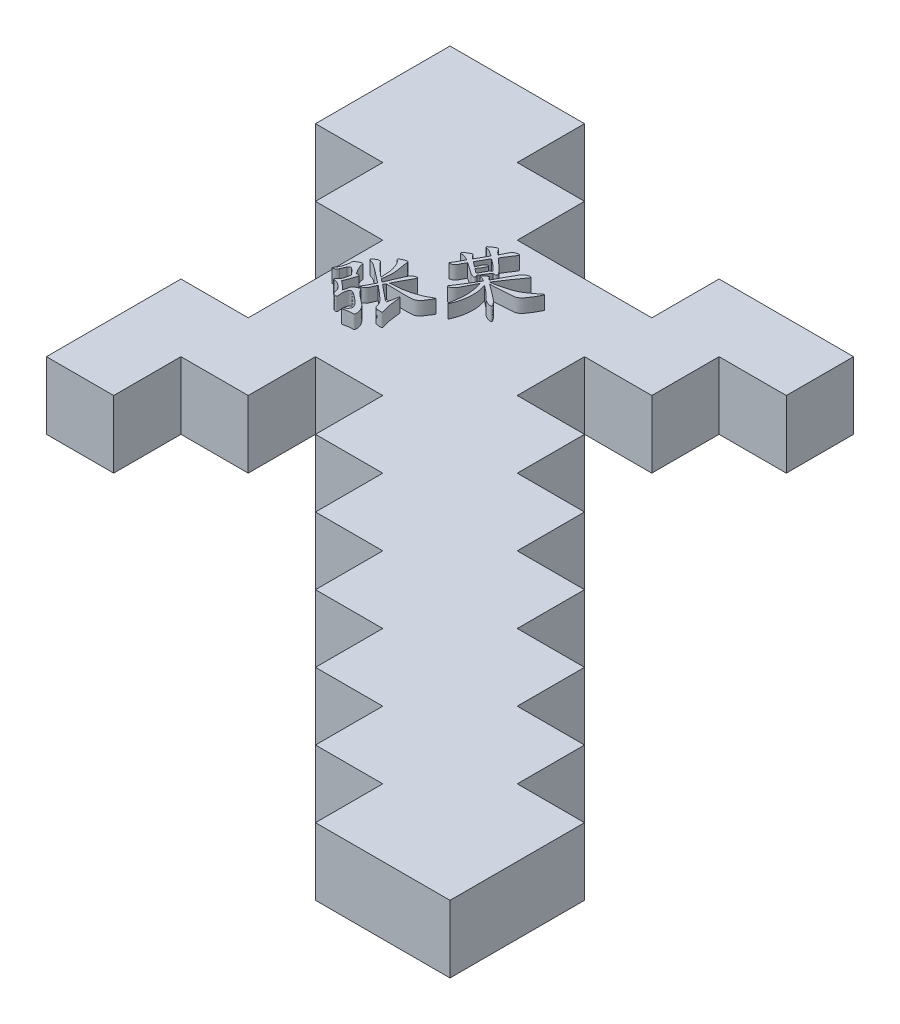
from build123d import *

# Parameters (mm, degrees)
EXTRUDE_1_DEPTH = 5
EXTRUDE_3_DEPTH = 1


with BuildPart() as part:
    # 草图1 → 凸台-拉伸1 (new body)
    with BuildSketch(Plane(origin=(0, 0, 0), x_dir=(1, 0, 0), z_dir=(0, 1, 0))):
        Polygon((-63.130219561, 0), (-58.130219561, 0), (-58.130219561, -5), (-48.130219561, -5), (-48.130219561, 0), (-38.130219561, 0), (-38.130219561, -5), (-43.130219561, -5), (-43.130219561, -10), (-48.130219561, -10), (-48.130219561, -15), (-43.130219561, -15), (-43.130219561, -20), (-38.130219561, -20), (-38.130219561, -25), (-33.130219561, -25), (-33.130219561, -30), (-28.130219561, -30), (-28.130219561, -35), (-23.130219561, -35), (-23.130219561, -40), (-18.130219561, -40), (-18.130219561, -50), (-28.130219561, -50), (-28.130219561, -45), (-33.130219561, -45), (-33.130219561, -40), (-38.130219561, -40), (-38.130219561, -35), (-43.130219561, -35), (-43.130219561, -30), (-48.130219561, -30), (-48.130219561, -25), (-53.130219561, -25), (-53.130219561, -20), (-58.130219561, -20), (-58.130219561, -25), (-63.130219561, -25), (-63.130219561, -30), (-68.130219561, -30), (-68.130219561, -20), (-63.130219561, -20), (-63.130219561, -10), (-68.130219561, -10), (-68.130219561, -5), (-73.130219561, -5), (-73.130219561, 5), (-63.130219561, 5), align=None)
    extrude(amount=EXTRUDE_1_DEPTH)

    # 草图7 → 凸台-拉伸3 (add)
    # profile 1 of 4: a face of its own
    with BuildSketch(Plane(origin=(0, 5, 0), x_dir=(1, 0, 0), z_dir=(0, 1, 0))):
        with BuildLine():
            add(Edge.make_bspline(
                [(-57.090632259, -7.991469364), (-57.12896008, -7.964786214), (-57.201994845, -7.913940702), (-57.30746532, -7.843172437), (-57.404513995, -7.783973908), (-57.491082161, -7.732761733), (-57.568693791, -7.692958184), (-57.636875541, -7.662967515), (-57.695459543, -7.641846621), (-57.745679395, -7.63263725), (-57.785831557, -7.628643865), (-57.815738119, -7.619157593), (-57.836430406, -7.606788832), (-57.847539113, -7.588609972), (-57.844109679, -7.566813763), (-57.830602901, -7.544182993), (-57.806964247, -7.519052656), (-57.737961053, -7.461205612), (-57.622041523, -7.378762702), (-57.503689201, -7.299160746), (-57.422609131, -7.256327718), (-57.384304212, -7.24359624), (-57.347610554, -7.239890388), (-57.313150835, -7.244110341), (-57.280601593, -7.256757825), (-57.251039659, -7.278258612), (-57.223516, -7.307739117), (-57.191304211, -7.359561129), (-57.145846452, -7.428930716), (-57.075312137, -7.508735389), (-56.993693924, -7.589763513), (-56.930899465, -7.639190311), (-56.898299576, -7.664850348)],
                knots=[0, 0, 0, 0, 1.980602943, 3.774095954, 5.385195833, 6.801005577, 8.03888147, 9.080973192, 9.960130792, 10.671101345, 11.240957986, 11.666977358, 11.993084103, 12.2452693, 12.5158187, 12.87747406, 13.354486223, 13.970874341, 16.69473991, 19.382127449, 20.011995386, 20.577492331, 21.082011399, 21.563561422, 22.036626702, 22.546321976, 23.100837353, 23.736040738, 25.128779013, 26.613925108, 28.24211138, 30, 30, 30, 30], degree=3))
            add(Edge.make_bspline(
                [(-56.898299576, -7.664850348), (-56.856985475, -7.585148952), (-56.772454687, -7.422075773), (-56.685581341, -7.23408478), (-56.619880118, -7.110393941), (-56.581934722, -7.054069149), (-56.539348015, -7.004167973), (-56.491632271, -6.961162856), (-56.440047604, -6.923998498), (-56.383598573, -6.893147043), (-56.322706195, -6.869086519), (-56.260578557, -6.851632102), (-56.203261683, -6.841777798), (-56.156836106, -6.840855176), (-56.121816785, -6.85100808), (-56.101262147, -6.877267375), (-56.103866071, -6.913903429), (-56.118399667, -6.957234258), (-56.147233187, -7.010977108), (-56.189984505, -7.073073942), (-56.240971021, -7.144470289), (-56.295010499, -7.225128986), (-56.353329609, -7.312271474), (-56.413494771, -7.407390591), (-56.479285222, -7.507990442), (-56.545055863, -7.617991273), (-56.61685558, -7.733560633), (-56.66425942, -7.814052595), (-56.688639624, -7.855450304)],
                knots=[0, 0, 0, 0, 2.929307648, 5.99351495, 6.756949934, 7.496690693, 8.205090066, 8.892296591, 9.587981125, 10.275446096, 10.985973739, 11.719989098, 12.378484629, 12.878066999, 13.229939503, 13.525871825, 13.884123202, 14.36707224, 15.024622916, 15.861062095, 16.828476243, 17.887118453, 19.02937812, 20.250229681, 21.55998466, 22.951640959, 24.432202698, 26, 26, 26, 26], degree=3))
            add(Edge.make_bspline(
                [(-56.688639624, -7.855450304), (-56.64874638, -7.890925945), (-56.571719312, -7.959423371), (-56.460510491, -8.059637954), (-56.356832699, -8.152593593), (-56.261517808, -8.239533851), (-56.17378958, -8.319278736), (-56.09395799, -8.392486201), (-56.023227368, -8.460718857), (-55.939852666, -8.538422275), (-55.850501724, -8.628452734), (-55.760881853, -8.732306263), (-55.692520718, -8.83029081), (-55.650986677, -8.907728163), (-55.631083568, -8.963335694), (-55.630575495, -8.998026759), (-55.645076487, -9.026185325), (-55.674559772, -9.042551328), (-55.714087415, -9.050480371), (-55.765320525, -9.048854303), (-55.828805447, -9.041949362), (-55.874908614, -9.03215634), (-55.900248894, -9.026773674)],
                knots=[0, 0, 0, 0, 1.715642914, 3.312614605, 4.810939105, 6.190629003, 7.458570877, 8.621044157, 9.67137473, 10.616741492, 12.283672131, 13.745331615, 15.019643053, 16.115445615, 16.561696677, 16.905211617, 17.20001396, 17.529580332, 17.948349052, 18.48663537, 19.16818982, 20, 20, 20, 20], degree=3))
            add(Edge.make_bspline(
                [(-55.900248894, -9.026773674), (-55.914969685, -9.049303809), (-55.945901173, -9.096644376), (-55.994601384, -9.170847495), (-56.046000651, -9.252745619), (-56.104004872, -9.340105863), (-56.164775774, -9.435308396), (-56.231286977, -9.536818697), (-56.300852878, -9.645796603), (-56.349267451, -9.720472011), (-56.374149695, -9.758850781)],
                knots=[0, 0, 0, 0, 0.740657657, 1.556277965, 2.442562073, 3.401451536, 4.441972137, 5.550788968, 6.741249494, 8, 8, 8, 8], degree=3))
            add(Edge.make_bspline(
                [(-56.374149695, -9.758850781), (-56.364553618, -9.778038884), (-56.347106758, -9.812925236), (-56.328343113, -9.862071311), (-56.319113736, -9.90255888), (-56.320552791, -9.9349465), (-56.333328113, -9.960394118), (-56.359607974, -9.97261443), (-56.393392552, -9.975169159), (-56.448313307, -9.965068289), (-56.517481136, -9.946248926), (-56.594317454, -9.91952383), (-56.660171818, -9.890269874), (-56.697304277, -9.865051469), (-56.714630527, -9.853284396)],
                knots=[0, 0, 0, 0, 1.244630136, 2.262892048, 3.048600354, 3.637449292, 4.117755162, 4.612754432, 5.236591537, 6.066307333, 7.835000185, 9.398978416, 10.786346188, 12, 12, 12, 12], degree=3))
            add(Edge.make_bspline(
                [(-56.714630527, -9.853284396), (-56.727019832, -9.844004293), (-56.757626891, -9.821078339), (-56.813216872, -9.781410446), (-56.887148903, -9.729554823), (-56.978537963, -9.664102422), (-57.090015406, -9.588537277), (-57.218684431, -9.498985232), (-57.366067005, -9.397765466), (-57.470383232, -9.326239229), (-57.525546706, -9.288415433)],
                knots=[0, 0, 0, 0, 0.375893873, 0.928624027, 1.65826865, 2.568892663, 3.658219232, 4.928502417, 6.375761072, 8, 8, 8, 8], degree=3))
            add(Edge.make_bspline(
                [(-57.525546706, -9.288415433), (-57.566201598, -9.356134451), (-57.648249551, -9.492802062), (-57.72147432, -9.656249331), (-57.772065531, -9.764059822), (-57.802128564, -9.812687155), (-57.837540632, -9.855307547), (-57.875862562, -9.894267652), (-57.918792379, -9.927559647), (-57.9659252, -9.955984447), (-58.016810181, -9.979161243), (-58.069549391, -9.996572275), (-58.118627631, -10.008076496), (-58.159246345, -10.015030164), (-58.189657898, -10.01537959), (-58.211909637, -10.008544156), (-58.22309106, -9.990798747), (-58.218766203, -9.96730001), (-58.204645182, -9.939944189), (-58.190408487, -9.920652857), (-58.182250193, -9.909598019)],
                knots=[0, 0, 0, 0, 3.618561838, 7.3028259, 8.203039248, 9.07756078, 9.915209135, 10.739243148, 11.57898249, 12.398856036, 13.258104, 14.137524852, 14.940541, 15.569814485, 16.020261946, 16.335038001, 16.584901296, 16.903828423, 17.371842249, 18, 18, 18, 18], degree=3))
            add(Edge.make_bspline(
                [(-58.182250193, -9.909598019), (-58.170592915, -9.893500294), (-58.14451248, -9.857485398), (-58.103814748, -9.795784756), (-58.058399741, -9.720183123), (-58.006429535, -9.631802678), (-57.948148027, -9.530430617), (-57.885270473, -9.415272293), (-57.816910112, -9.286848335), (-57.76953597, -9.196889), (-57.744736656, -9.149797283)],
                knots=[0, 0, 0, 0, 0.54360168, 1.216181677, 2.020877555, 2.955639438, 4.020635478, 5.219054618, 6.544236745, 8, 8, 8, 8], degree=3))
            add(Edge.make_bspline(
                [(-57.744736656, -9.149797283), (-57.77258089, -9.133323129), (-57.82588684, -9.101784448), (-57.905438934, -9.061085076), (-57.979548375, -9.026309736), (-58.048961229, -8.997937693), (-58.113997517, -8.977898956), (-58.174018178, -8.965072386), (-58.22910009, -8.956674258), (-58.278751473, -8.958980836), (-58.321413866, -8.961492048), (-58.356423281, -8.960360722), (-58.38323063, -8.95499918), (-58.402422008, -8.944845914), (-58.412731802, -8.928749254), (-58.413071481, -8.908563867), (-58.402517436, -8.886231078), (-58.391915176, -8.871477247), (-58.385845601, -8.863030984)],
                knots=[0, 0, 0, 0, 1.962620562, 3.757307723, 5.419287501, 6.929089491, 8.30370031, 9.541006395, 10.653801285, 11.6702689, 12.5471045, 13.248888065, 13.788689604, 14.197385674, 14.528003306, 14.896396965, 15.368210087, 16, 16, 16, 16], degree=3))
            add(Edge.make_bspline(
                [(-58.385845601, -8.863030984), (-58.367692821, -8.841056722), (-58.329809174, -8.795197898), (-58.257720561, -8.735650674), (-58.175311565, -8.676320589), (-58.098785292, -8.631071066), (-58.035462739, -8.599482977), (-57.992347034, -8.580022233), (-57.953869194, -8.566496496), (-57.92010419, -8.559232197), (-57.890876154, -8.557663938), (-57.866671185, -8.562749935), (-57.846599689, -8.573465909), (-57.82697871, -8.600372969), (-57.798663888, -8.644780418), (-57.742790624, -8.703234607), (-57.67037841, -8.778835703), (-57.612856671, -8.831345453), (-57.580993966, -8.860431894)],
                knots=[0, 0, 0, 0, 1.323142054, 2.761309577, 4.330763745, 6.047188682, 6.888276329, 7.622109992, 8.246600159, 8.78142658, 9.224944804, 9.596504791, 9.921424573, 10.255112737, 11.123438005, 12.379622114, 13.994583703, 16, 16, 16, 16], degree=3))
            add(Edge.make_bspline(
                [(-57.580993966, -8.860431894), (-57.541217134, -8.794715502), (-57.459298363, -8.659375261), (-57.33750592, -8.448787813), (-57.214583054, -8.224400992), (-57.132631673, -8.070395779), (-57.090632259, -7.991469364)],
                knots=[0, 0, 0, 0, 0.923680373, 1.902282206, 2.924936748, 4, 4, 4, 4], degree=3))
        make_face()
        with BuildLine():
            add(Edge.make_bspline(
                [(-57.003995915, -9.304876338), (-56.989804481, -9.267811647), (-56.96214773, -9.195578715), (-56.917809122, -9.092164518), (-56.874275855, -8.995646553), (-56.832664972, -8.906886006), (-56.787548422, -8.829702528), (-56.733724293, -8.769547776), (-56.672776645, -8.726814186), (-56.616979132, -8.708547395), (-56.575895076, -8.704578824), (-56.5500887, -8.710321589), (-56.535437613, -8.730504882), (-56.531147003, -8.758126427), (-56.535790853, -8.793841523), (-56.548980028, -8.83824159), (-56.56870414, -8.892186666), (-56.6087279, -8.97350345), (-56.663452511, -9.07669783), (-56.734199964, -9.1939152), (-56.810244169, -9.298010344), (-56.865485881, -9.360424249), (-56.892235032, -9.390646319)],
                knots=[0, 0, 0, 0, 1.500508182, 2.92424136, 4.253563156, 5.503753539, 6.631132626, 7.620512224, 8.532119455, 9.416103834, 9.798899765, 10.095934496, 10.360260676, 10.683624304, 11.133437605, 11.710918479, 12.432991487, 13.302424248, 15.134283063, 16.849677312, 18.47455026, 20, 20, 20, 20], degree=3))
            Line((-56.892235032, -9.390646319), (-56.537892385, -9.663550802))
            add(Edge.make_bspline(
                [(-56.537892385, -9.663550802), (-56.50977451, -9.614804788), (-56.456330272, -9.522152214), (-56.382412864, -9.3903006), (-56.317567246, -9.273388893), (-56.262945794, -9.17147868), (-56.215252068, -9.085607373), (-56.168402385, -9.021012413), (-56.125069498, -8.973306716), (-56.087529694, -8.95355804), (-56.060781455, -8.94236323), (-56.05416543, -8.922619129), (-56.059745946, -8.899742161), (-56.073383962, -8.871988371), (-56.096941078, -8.839345096), (-56.128230827, -8.799857318), (-56.170007507, -8.755643613), (-56.220254606, -8.705359685), (-56.278949938, -8.650538857), (-56.344817717, -8.590776622), (-56.417405562, -8.526719578), (-56.497467368, -8.458905285), (-56.58492382, -8.387637436), (-56.678309152, -8.310736089), (-56.779978694, -8.231472868), (-56.850059428, -8.177142667), (-56.886170488, -8.14914751)],
                knots=[0, 0, 0, 0, 1.987437719, 3.77756469, 5.338834308, 6.707983022, 7.864296221, 8.798638426, 9.534266684, 10.095973164, 10.311129052, 10.508111552, 10.766338905, 11.126796723, 11.596410857, 12.184181197, 12.905962104, 13.742558945, 14.694985448, 15.741949377, 16.883731983, 18.113929583, 19.447279876, 20.868180226, 22.386242204, 24, 24, 24, 24], degree=3))
            add(Edge.make_bspline(
                [(-56.886170488, -8.14914751), (-56.90259621, -8.177469177), (-56.936813856, -8.23646815), (-56.990757086, -8.327835507), (-57.046766795, -8.426493145), (-57.105705036, -8.531922586), (-57.169071683, -8.6434515), (-57.235878514, -8.76193049), (-57.304792703, -8.887644515), (-57.352243208, -8.973365024), (-57.376532194, -9.017243677)],
                knots=[0, 0, 0, 0, 0.788086498, 1.641721677, 2.553944254, 3.518786121, 4.549140596, 5.641593005, 6.792777553, 8, 8, 8, 8], degree=3))
            Line((-57.376532194, -9.017243677), (-57.003995915, -9.304876338))
        make_face(mode=Mode.SUBTRACT)
    # profile 2 of 4: a face of its own
    with BuildSketch(Plane(origin=(0, 5, 0), x_dir=(1, 0, 0), z_dir=(0, 1, 0))):
        with BuildLine():
            add(Edge.make_bspline(
                [(-55.606551688, -9.609836269), (-55.582193816, -9.565995179), (-55.534676167, -9.480469416), (-55.467035345, -9.354826589), (-55.401306311, -9.237438529), (-55.34217627, -9.126164705), (-55.285357498, -9.022764906), (-55.232675527, -8.926530715), (-55.185083733, -8.836664238), (-55.126628957, -8.728144259), (-55.058171212, -8.60032494), (-54.977268206, -8.454205573), (-54.898358521, -8.315905583), (-54.834471214, -8.205024299), (-54.781568483, -8.122400695), (-54.738021929, -8.067311506), (-54.690236665, -8.018675947), (-54.638943934, -7.976331692), (-54.584990472, -7.938941795), (-54.526001716, -7.909797884), (-54.464025722, -7.885415711), (-54.400888549, -7.86825634), (-54.343036039, -7.856274961), (-54.294668121, -7.854195828), (-54.258415938, -7.858328024), (-54.231793735, -7.873729575), (-54.224094026, -7.902132237), (-54.230506686, -7.935573283), (-54.250186048, -7.975754491), (-54.280965119, -8.023662212), (-54.32105888, -8.078349823), (-54.364515738, -8.142224854), (-54.415596416, -8.211315305), (-54.470492848, -8.288029835), (-54.530087751, -8.371756992), (-54.596812898, -8.460505251), (-54.666011293, -8.558096751), (-54.742928026, -8.660353384), (-54.822129484, -8.770258786), (-54.904972949, -8.88676207), (-54.989900956, -9.010174596), (-55.079130573, -9.139551498), (-55.169415691, -9.276327452), (-55.263347517, -9.419332368), (-55.359376865, -9.569493731), (-55.424358304, -9.671905711), (-55.457537176, -9.724196243)],
                knots=[0, 0, 0, 0, 1.448093778, 2.824959963, 4.119986515, 5.332495216, 6.463135999, 7.526563905, 8.500191027, 9.399266558, 11.085596972, 12.686758902, 14.221584836, 15.683108196, 16.381542897, 17.052198558, 17.706693995, 18.346198383, 18.970630196, 19.597118536, 20.241281017, 20.89071083, 21.484376813, 21.943290125, 22.281893549, 22.533982678, 22.77129677, 23.074359428, 23.503603154, 24.054251149, 24.718238636, 25.460774804, 26.284713508, 27.198782654, 28.18458081, 29.251924388, 30.404460495, 31.638567017, 32.946202732, 34.315854113, 35.766106899, 37.271753753, 38.853605973, 40.497956519, 42.211891629, 44, 44, 44, 44], degree=3))
            add(Edge.make_bspline(
                [(-55.457537176, -9.724196243), (-55.426910296, -9.721164949), (-55.362953662, -9.714834843), (-55.262603001, -9.701877884), (-55.153511902, -9.683245928), (-55.035438991, -9.660701448), (-54.908329641, -9.634563466), (-54.772423712, -9.604589869), (-54.628062836, -9.568267161), (-54.476461587, -9.530799297), (-54.323546992, -9.48710453), (-54.173555518, -9.439103319), (-54.029595176, -9.384902195), (-53.890578834, -9.327170885), (-53.757454663, -9.263837471), (-53.629647477, -9.196463823), (-53.508177543, -9.123418091), (-53.393225542, -9.046310963), (-53.284177073, -8.969746739), (-53.182436795, -8.895995133), (-53.087645933, -8.827748583), (-53.00096107, -8.763313286), (-52.921269211, -8.703869718), (-52.849421068, -8.648403063), (-52.784985775, -8.597442234), (-52.730730015, -8.551536911), (-52.685214807, -8.514576172), (-52.652730333, -8.494468411), (-52.623843219, -8.483724099), (-52.608233074, -8.506166437), (-52.617667995, -8.538388838), (-52.631734298, -8.584534111), (-52.659684695, -8.647445571), (-52.712619037, -8.752776318), (-52.788889582, -8.895663145), (-52.891776555, -9.066897092), (-53.001048531, -9.237146663), (-53.097098228, -9.376058452), (-53.178626347, -9.481238333), (-53.242394695, -9.550525036), (-53.308706521, -9.610174912), (-53.377431746, -9.660060522), (-53.448737192, -9.699995681), (-53.522041919, -9.731103318), (-53.598304644, -9.751025847), (-53.758279926, -9.771510743), (-54.009367596, -9.782554534), (-54.264748931, -9.802259059), (-54.445643419, -9.811671496), (-54.546972238, -9.818052311), (-54.656425722, -9.824095907), (-54.773993805, -9.829854328), (-54.899583985, -9.837105608), (-55.033298064, -9.843950933), (-55.175093174, -9.850886142), (-55.272422891, -9.855333355), (-55.32238448, -9.857616213)],
                knots=[0, 0, 0, 0, 0.762831999, 1.592985172, 2.50734523, 3.505507302, 4.572422798, 5.723829828, 6.954729772, 8.262017102, 9.594306489, 10.895917918, 12.164334508, 13.40598958, 14.625913593, 15.817106483, 16.985783706, 18.137257484, 19.247338384, 20.288317479, 21.251924938, 22.142409614, 22.965589841, 23.715824494, 24.393276257, 24.998166537, 25.487855163, 25.818137174, 25.99936551, 26.136867909, 26.388319663, 26.786736603, 27.354441202, 28.081119448, 29.714434732, 31.364339294, 33.032220096, 34.728128327, 35.548690132, 36.328757631, 37.058742334, 37.756059243, 38.429071885, 39.080457978, 39.724606442, 40.375520402, 43.073892076, 45.950312911, 46.724578611, 47.563572594, 48.466882577, 49.441671328, 50.481172739, 51.585004827, 52.760327282, 54, 54, 54, 54], degree=3))
            add(Edge.make_bspline(
                [(-55.32238448, -9.857616213), (-55.28536634, -9.884690184), (-55.21319646, -9.937473097), (-55.108580947, -10.015837158), (-55.008624711, -10.089329052), (-54.914598013, -10.159375164), (-54.825835289, -10.225367481), (-54.743050886, -10.287587511), (-54.665516698, -10.345739171), (-54.593947702, -10.400479489), (-54.527022487, -10.45035399), (-54.466578255, -10.497116043), (-54.411886958, -10.540175247), (-54.361547843, -10.577712773), (-54.317311356, -10.612323594), (-54.279322801, -10.643745828), (-54.2464156, -10.670620475), (-54.192443616, -10.713958537), (-54.119955434, -10.780013587), (-54.03035088, -10.872743232), (-53.947886713, -10.971946952), (-53.886712691, -11.056586913), (-53.845844464, -11.120785169), (-53.831273811, -11.160161768), (-53.829460573, -11.19488877), (-53.853736098, -11.216676736), (-53.8899288, -11.223164692), (-53.939260034, -11.221229288), (-54.00366871, -11.208805619), (-54.079482096, -11.187506598), (-54.159919533, -11.161076112), (-54.237513557, -11.131160962), (-54.307427903, -11.097005744), (-54.371662618, -11.061728287), (-54.42840276, -11.022652555), (-54.479563298, -10.982023042), (-54.523293586, -10.93760087), (-54.56168307, -10.886885792), (-54.607222859, -10.829305795), (-54.669854063, -10.763647842), (-54.751616706, -10.686215058), (-54.851706399, -10.596455014), (-54.972102101, -10.495454817), (-55.109893397, -10.380916307), (-55.268580626, -10.256521504), (-55.380404577, -10.169471284), (-55.439343544, -10.123589789)],
                knots=[0, 0, 0, 0, 1.501754896, 2.92779354, 4.280093925, 5.564287594, 6.767149508, 7.901919288, 8.955365598, 9.940740358, 10.85234071, 11.688364798, 12.443102824, 13.131540216, 13.744458894, 14.282062523, 14.745812665, 15.135710637, 16.548519267, 17.952979937, 19.356262193, 20.765553571, 21.380220535, 21.828777675, 22.150851559, 22.431692751, 22.803270897, 23.332914553, 24.043405402, 24.944944503, 25.910842174, 26.815203775, 27.665334943, 28.457080298, 29.212469701, 29.918414978, 30.59380428, 31.246570945, 31.999767114, 32.996645484, 34.213917869, 35.687177528, 37.398057021, 39.359528095, 41.554149901, 44, 44, 44, 44], degree=3))
            add(Edge.make_bspline(
                [(-55.439343544, -10.123589789), (-55.421808367, -10.179468657), (-55.387305002, -10.289419582), (-55.344743319, -10.45479258), (-55.311111912, -10.617294867), (-55.28523803, -10.777372237), (-55.270347779, -10.935107084), (-55.261682478, -11.090347209), (-55.263932926, -11.243087794), (-55.276565917, -11.440281222), (-55.307834757, -11.676901447), (-55.358660329, -11.947801153), (-55.426918123, -12.201063172), (-55.491509918, -12.379101724), (-55.535841485, -12.489119903), (-55.556357986, -12.534060508), (-55.572594611, -12.572314072), (-55.589337986, -12.601867755), (-55.600862785, -12.625577875), (-55.612882137, -12.640317025), (-55.620773699, -12.649969967), (-55.631513819, -12.652334094), (-55.636478267, -12.641059328), (-55.636870247, -12.626508509), (-55.63839022, -12.604161175), (-55.635965637, -12.574475965), (-55.631448241, -12.537514958), (-55.625526784, -12.492977402), (-55.616493983, -12.441087756), (-55.595181686, -12.318884051), (-55.563249231, -12.128391022), (-55.535473745, -11.869215646), (-55.517532338, -11.606796651), (-55.514182508, -11.385012529), (-55.517788463, -11.204060782), (-55.528729369, -11.063904858), (-55.545143189, -10.919984947), (-55.567867415, -10.772339193), (-55.596619327, -10.620674753), (-55.631033767, -10.46480287), (-55.672920691, -10.305153153), (-55.704731581, -10.198011812), (-55.720911662, -10.143516148)],
                knots=[0, 0, 0, 0, 1.364607632, 2.685091471, 3.977215506, 5.230769511, 6.461554422, 7.667696238, 8.852203677, 10.018796564, 12.270871463, 14.409017383, 16.438248792, 18.375309992, 18.818961485, 19.201609917, 19.526872049, 19.785769601, 19.993629768, 20.137652096, 20.228191238, 20.282447986, 20.355241053, 20.46375455, 20.638856676, 20.868062728, 21.159390495, 21.505824107, 21.915177079, 22.386497863, 24.396804314, 26.414520245, 28.458063063, 30.524361528, 31.581270648, 32.674472412, 33.798899913, 34.956255479, 36.154712866, 37.395612179, 38.675321393, 40, 40, 40, 40], degree=3))
            add(Edge.make_bspline(
                [(-55.720911662, -10.143516148), (-55.753670239, -10.201492691), (-55.816441186, -10.312585505), (-55.904563121, -10.473162185), (-55.984821171, -10.619420234), (-56.054557197, -10.752508018), (-56.115729921, -10.871674097), (-56.167330248, -10.976841272), (-56.210849418, -11.067964241), (-56.243456984, -11.147933298), (-56.273964681, -11.218799532), (-56.309539568, -11.28164513), (-56.349249225, -11.339626139), (-56.39519593, -11.390760904), (-56.444142739, -11.437891937), (-56.49862398, -11.478965871), (-56.557705238, -11.514460618), (-56.618411994, -11.543281245), (-56.674102015, -11.56500219), (-56.719070521, -11.574628832), (-56.752596822, -11.578274175), (-56.776065846, -11.561357819), (-56.775428612, -11.530765058), (-56.761872472, -11.494944975), (-56.736027877, -11.447133978), (-56.680919802, -11.367282764), (-56.599677399, -11.252484623), (-56.498518915, -11.099646519), (-56.390461267, -10.931575339), (-56.276694936, -10.748097651), (-56.155689433, -10.550273905), (-56.028514575, -10.338594771), (-55.893911571, -10.11410547), (-55.802555432, -9.959607854), (-55.755566199, -9.880141662)],
                knots=[0, 0, 0, 0, 1.670719355, 3.201379419, 4.595555756, 5.856298839, 6.971004299, 7.956076705, 8.795620769, 9.503461238, 10.122901107, 10.729538509, 11.312432298, 11.882255365, 12.451156387, 13.01486609, 13.590190392, 14.17676518, 14.701703721, 15.079723248, 15.340662949, 15.516058665, 15.727300357, 16.038942396, 16.489448935, 17.080259619, 18.475170035, 20.016493753, 21.678628498, 23.488097228, 25.43283048, 27.496789432, 29.683763651, 32, 32, 32, 32], degree=3))
            add(Edge.make_bspline(
                [(-55.755566199, -9.880141662), (-55.790496272, -9.859099336), (-55.856194756, -9.819521723), (-55.953331639, -9.771782584), (-56.042949896, -9.740105907), (-56.11169692, -9.728379769), (-56.157509312, -9.723422385), (-56.180437249, -9.711564572), (-56.191017901, -9.690363737), (-56.182201767, -9.665633747), (-56.165877152, -9.636983594), (-56.136093551, -9.603783402), (-56.09519787, -9.564924082), (-56.044639615, -9.523617677), (-55.992533504, -9.482276942), (-55.943369689, -9.447512301), (-55.90071731, -9.421401031), (-55.865270853, -9.402231989), (-55.835421808, -9.391862819), (-55.810966565, -9.389424586), (-55.79107639, -9.397707155), (-55.779080236, -9.424256569), (-55.761842444, -9.461532274), (-55.722589668, -9.507582561), (-55.670734476, -9.558422081), (-55.629147785, -9.591735466), (-55.606551688, -9.609836269)],
                knots=[0, 0, 0, 0, 2.288062034, 4.303518281, 6.066851595, 7.599310386, 8.209699452, 8.646152603, 8.986937049, 9.435268646, 10.03040102, 10.85851265, 11.913249347, 13.202080057, 14.518543954, 15.647286049, 16.578589885, 17.325281578, 17.904528959, 18.342484535, 18.683268981, 19.025207979, 19.916875796, 21.013023883, 22.377028773, 24, 24, 24, 24], degree=3))
        make_face()
    # profile 3 of 4: a face of its own
    with BuildSketch(Plane(origin=(0, 5, 0), x_dir=(1, 0, 0), z_dir=(0, 1, 0))):
        with BuildLine():
            add(Edge.make_bspline(
                [(-59.288790613, -13.857348716), (-59.246915377, -13.891713202), (-59.167452835, -13.956923326), (-59.054391944, -14.049737683), (-58.954464696, -14.133024941), (-58.865862334, -14.204941076), (-58.78970833, -14.266201905), (-58.726388495, -14.317581608), (-58.675350085, -14.358403857), (-58.645105721, -14.381816889), (-58.632087126, -14.391894958)],
                knots=[0, 0, 0, 0, 1.535334226, 2.913453651, 4.14588546, 5.222234562, 6.147717355, 6.915973312, 7.533383961, 8, 8, 8, 8], degree=3))
            add(Edge.make_bspline(
                [(-58.632087126, -14.391894958), (-58.60808216, -14.410621053), (-58.554917173, -14.452094661), (-58.46847112, -14.521291421), (-58.367948055, -14.603939066), (-58.277353556, -14.678851631), (-58.204226042, -14.739652347), (-58.153004777, -14.774751526), (-58.10994574, -14.801697887), (-58.07352169, -14.818231763), (-58.043578012, -14.824733412), (-58.018199707, -14.821723874), (-58.000991821, -14.803529847), (-57.992924714, -14.763972249), (-57.984203849, -14.700354068), (-57.968043288, -14.606377758), (-57.948200713, -14.490058846), (-57.929102957, -14.381462841), (-57.91308962, -14.290631629), (-57.899752485, -14.228377672), (-57.888118715, -14.174158933), (-57.875568739, -14.129087712), (-57.865981234, -14.091526949), (-57.854420458, -14.063174023), (-57.8447765, -14.042266578), (-57.83546667, -14.029207939), (-57.823597262, -14.023445279), (-57.812656627, -14.031612514), (-57.806449176, -14.046775445), (-57.796791505, -14.068275862), (-57.791274608, -14.09931158), (-57.783802153, -14.138125768), (-57.778388347, -14.185674821), (-57.765578702, -14.303490971), (-57.745534913, -14.495745452), (-57.720249291, -14.714768414), (-57.695539717, -14.893242695), (-57.669762469, -15.02135479), (-57.641882902, -15.14215115), (-57.608722803, -15.253163883), (-57.576151703, -15.352966287), (-57.550247226, -15.440868722), (-57.529497988, -15.514734744), (-57.515865077, -15.567210919), (-57.511068004, -15.603091812), (-57.51754168, -15.625645631), (-57.532723091, -15.643849819), (-57.55544481, -15.657813519), (-57.586137732, -15.666797107), (-57.624006168, -15.672388235), (-57.669535684, -15.674777171), (-57.736966994, -15.673165098), (-57.818291504, -15.666702373), (-57.903632663, -15.652217618), (-57.971988276, -15.634756993), (-58.006893938, -15.61331818), (-58.022167264, -15.60393741)],
                knots=[0, 0, 0, 0, 1.312976345, 2.907913699, 4.775280006, 6.92484048, 7.979056965, 8.873866711, 9.600074937, 10.169172797, 10.58690501, 10.916651905, 11.216075227, 11.594245308, 12.628257941, 14.004169748, 15.697460096, 17.720442125, 18.758646516, 19.674614294, 20.466226329, 21.148948401, 21.692963421, 22.13469864, 22.468884411, 22.680974661, 22.826749305, 22.97199095, 23.200622761, 23.535966891, 23.98311167, 24.552345792, 25.242861619, 26.044694706, 29.664654932, 33.57764622, 35.553852706, 37.432151484, 39.211427022, 40.898246963, 42.426535487, 43.738743716, 44.850745158, 45.732897834, 46.082508614, 46.393867822, 46.712855293, 47.082521422, 47.527579977, 48.082463669, 48.731167709, 49.490986255, 50.990690797, 52.241719542, 53.23064658, 54, 54, 54, 54], degree=3))
            add(Edge.make_bspline(
                [(-58.022167264, -15.60393741), (-58.037142324, -15.590474714), (-58.068684059, -15.562118449), (-58.101197227, -15.502823338), (-58.126086723, -15.431655063), (-58.136268967, -15.363209361), (-58.14893674, -15.301854365), (-58.167235086, -15.250556531), (-58.196068034, -15.197050937), (-58.231542406, -15.139248336), (-58.276922892, -15.079295131), (-58.330414599, -15.015674861), (-58.391558935, -14.94820506), (-58.462745762, -14.877773206), (-58.543307898, -14.802113133), (-58.633147427, -14.718929985), (-58.734088433, -14.6286922), (-58.845557821, -14.531067267), (-58.967768292, -14.426287679), (-59.100358032, -14.31456135), (-59.243640955, -14.195626529), (-59.343031142, -14.114307135), (-59.394486952, -14.072206849)],
                knots=[0, 0, 0, 0, 0.571899182, 1.204582294, 1.90408848, 2.719835844, 3.176365622, 3.69321285, 4.269028789, 4.910266397, 5.629929855, 6.415043792, 7.285523009, 8.230907371, 9.275906175, 10.443980702, 11.729744457, 13.145068581, 14.678471803, 16.330089994, 18.100031801, 20, 20, 20, 20], degree=3))
            add(Edge.make_bspline(
                [(-59.394486952, -14.072206849), (-59.414526575, -14.11692211), (-59.452029403, -14.200603762), (-59.502892237, -14.318504999), (-59.542870921, -14.420997277), (-59.569590374, -14.512236013), (-59.605210329, -14.59570418), (-59.670089263, -14.667862906), (-59.756326562, -14.736335369), (-59.842012157, -14.785740446), (-59.911595633, -14.818618005), (-59.953419724, -14.83358748), (-59.984411783, -14.838821695), (-60.007881565, -14.827443257), (-60.010317183, -14.799928785), (-59.998944136, -14.76750354), (-59.977568256, -14.722502607), (-59.943545549, -14.668622952), (-59.90306201, -14.604673533), (-59.859811905, -14.531993029), (-59.815075661, -14.451506731), (-59.768271363, -14.363998658), (-59.719739998, -14.269123735), (-59.668740879, -14.167261094), (-59.615688252, -14.057893945), (-59.580633804, -13.982162232), (-59.56256146, -13.943118697)],
                knots=[0, 0, 0, 0, 1.732428183, 3.242124718, 4.541200085, 5.616453353, 6.607753702, 7.716425661, 9.001743992, 10.493795651, 11.201964987, 11.718600865, 12.066372033, 12.290547508, 12.540871119, 12.942096343, 13.517633261, 14.29164472, 15.195411478, 16.193577196, 17.281554658, 18.451005144, 19.702289947, 21.049395397, 22.478813823, 24, 24, 24, 24], degree=3))
            Line((-59.56256146, -13.943118697), (-60.605663041, -13.139133425))
            add(Edge.make_bspline(
                [(-60.605663041, -13.139133425), (-60.634161328, -13.11735517), (-60.688959675, -13.075478537), (-60.769536531, -13.016932554), (-60.845929285, -12.966589806), (-60.915626222, -12.920297085), (-60.982228417, -12.883880496), (-61.042221912, -12.850674764), (-61.098582284, -12.826805358), (-61.163112796, -12.803797739), (-61.231817044, -12.781866151), (-61.299221732, -12.75428586), (-61.345875458, -12.726452539), (-61.375594071, -12.702973054), (-61.382122647, -12.677852791), (-61.373732713, -12.658459964), (-61.35810727, -12.637113166), (-61.332219882, -12.613659884), (-61.298609685, -12.585979259), (-61.255610833, -12.55533888), (-61.20255515, -12.523296377), (-61.143851179, -12.487815411), (-61.083225616, -12.455710373), (-61.024453988, -12.433328832), (-60.971030836, -12.421405764), (-60.922431472, -12.41948168), (-60.878959558, -12.43021037), (-60.841339879, -12.451907947), (-60.809070243, -12.484033741), (-60.789693865, -12.520281122), (-60.771580071, -12.553892918), (-60.749731197, -12.583360021), (-60.723115584, -12.617908961), (-60.690322021, -12.657073923), (-60.649710272, -12.698894527), (-60.605050436, -12.747183854), (-60.553146304, -12.798718153), (-60.494512096, -12.854131485), (-60.431051112, -12.914902795), (-60.360098974, -12.978751975), (-60.284560929, -13.04859271), (-60.200663739, -13.120477014), (-60.112988173, -13.199328167), (-60.016926926, -13.280134652), (-59.916280301, -13.367035835), (-59.846240498, -13.425427349), (-59.810341403, -13.45535608)],
                knots=[0, 0, 0, 0, 1.585079966, 3.047894081, 4.400021714, 5.628442695, 6.74285125, 7.753321772, 8.656555257, 9.443785634, 10.779674544, 11.848806216, 12.638927795, 13.207525064, 13.442847845, 13.725350513, 14.100697183, 14.615156688, 15.258982534, 16.027472875, 16.944663647, 17.997445955, 19.059086658, 19.971737955, 20.767712747, 21.469748088, 22.10118537, 22.718536777, 23.36828038, 24.083986677, 24.52405027, 25.055177366, 25.701023854, 26.452692895, 27.310420839, 28.276391474, 29.359297479, 30.541779818, 31.841768272, 33.241947543, 34.759733874, 36.387698566, 38.123728956, 39.970322736, 41.934577782, 44, 44, 44, 44], degree=3))
            add(Edge.make_bspline(
                [(-59.810341403, -13.45535608), (-59.812670942, -13.389501467), (-59.817179113, -13.262058266), (-59.828092104, -13.077700627), (-59.843815388, -12.906991261), (-59.862443869, -12.749709857), (-59.8855728, -12.605992251), (-59.912972175, -12.475775162), (-59.944773659, -12.359442363), (-59.980641977, -12.256439653), (-60.018532114, -12.164995979), (-60.055543513, -12.082511142), (-60.092744532, -12.008737042), (-60.12961734, -11.943687372), (-60.166891543, -11.887680157), (-60.204282789, -11.841079863), (-60.240069626, -11.801416971), (-60.277977066, -11.774051942), (-60.311229708, -11.751107946), (-60.334219144, -11.726089524), (-60.347988716, -11.700632146), (-60.350655079, -11.674668517), (-60.344156757, -11.648643055), (-60.326008145, -11.623850546), (-60.298519304, -11.600156489), (-60.250601047, -11.568360708), (-60.184155419, -11.532355819), (-60.102186218, -11.494984024), (-60.02011429, -11.46546298), (-59.95271649, -11.446365952), (-59.901679318, -11.436083238), (-59.868354419, -11.434427024), (-59.840672822, -11.440213293), (-59.816515166, -11.448719926), (-59.799752814, -11.46700104), (-59.78684877, -11.489257941), (-59.781490723, -11.517951224), (-59.781699705, -11.552231818), (-59.782571687, -11.595074569), (-59.777061053, -11.649090548), (-59.769529895, -11.715251613), (-59.757937673, -11.793500609), (-59.743130224, -11.883594359), (-59.724942059, -11.986180278), (-59.702438559, -12.100794556), (-59.675749942, -12.226495739), (-59.650355853, -12.362126048), (-59.635798389, -12.507285742), (-59.627187487, -12.659903548), (-59.625092739, -12.820676314), (-59.632916391, -12.989729137), (-59.646484457, -13.166910579), (-59.668264323, -13.352162594), (-59.688306374, -13.477659178), (-59.69858052, -13.541992424)],
                knots=[0, 0, 0, 0, 2.212091402, 4.280884733, 6.198677617, 7.966315497, 9.596768267, 11.083681808, 12.431371426, 13.642421269, 14.742406575, 15.753345213, 16.676829518, 17.514950432, 18.262441592, 18.9316503, 19.521350118, 20.046829919, 20.496663783, 20.874255902, 21.177745052, 21.450747615, 21.730550786, 22.058595372, 22.46357003, 22.944895222, 23.9863323, 24.997270939, 25.966343605, 26.911853443, 27.345409371, 27.713931911, 28.020042047, 28.293732275, 28.554226878, 28.832007349, 29.149570419, 29.518092959, 29.983434012, 30.586450929, 31.338017349, 32.219586993, 33.241207055, 34.403145032, 35.71693396, 37.161918048, 38.717532186, 40.345908459, 42.054910918, 43.848517698, 45.740555969, 47.733994078, 49.813119658, 52, 52, 52, 52], degree=3))
            Line((-59.69858052, -13.541992424), (-59.45686512, -13.7273942))
            add(Edge.make_bspline(
                [(-59.45686512, -13.7273942), (-59.439511837, -13.686397273), (-59.405558804, -13.606183627), (-59.356300575, -13.488594644), (-59.309721382, -13.376625505), (-59.264510117, -13.271118873), (-59.221871092, -13.171277687), (-59.182387214, -13.077265485), (-59.144927387, -12.989148749), (-59.109417293, -12.907252287), (-59.076470055, -12.830609611), (-59.0456184, -12.760121119), (-59.016454714, -12.695688503), (-58.991170275, -12.636616921), (-58.965921035, -12.584188054), (-58.946504205, -12.536088314), (-58.92538837, -12.495746806), (-58.904502675, -12.448481872), (-58.877153584, -12.395986645), (-58.839349755, -12.339824654), (-58.799605215, -12.287848621), (-58.755384982, -12.242002914), (-58.707529957, -12.201822838), (-58.655744162, -12.167593349), (-58.600302941, -12.139463832), (-58.544674457, -12.116397017), (-58.493610753, -12.102567434), (-58.452308078, -12.098467081), (-58.419583696, -12.108252231), (-58.403808293, -12.137697506), (-58.407056006, -12.176155716), (-58.421415824, -12.224638026), (-58.448244799, -12.285585272), (-58.501816267, -12.380877546), (-58.574554179, -12.504491089), (-58.657557351, -12.65101651), (-58.73442614, -12.789479146), (-58.807702031, -12.92248365), (-58.878319655, -13.057888805), (-58.952691278, -13.200618644), (-59.032840275, -13.35431461), (-59.087292886, -13.460803782), (-59.115517925, -13.516001521)],
                knots=[0, 0, 0, 0, 1.481205779, 2.898093159, 4.241806855, 5.516083885, 6.717184906, 7.853956224, 8.90870529, 9.902894958, 10.82390872, 11.684392741, 12.462918508, 13.177057031, 13.821972841, 14.398562949, 14.901336413, 15.33553009, 16.117782439, 16.86662931, 17.585471038, 18.292202229, 18.981139099, 19.660698571, 20.352577343, 21.04665436, 21.661898597, 22.104307193, 22.423708556, 22.72526856, 23.12882559, 23.676594408, 24.40835602, 25.337006552, 27.313019893, 29.180557513, 30.939753028, 32.582328962, 34.232755034, 36.02058178, 37.937303071, 40, 40, 40, 40], degree=3))
            add(Edge.make_bspline(
                [(-59.115517925, -13.516001521), (-59.04590472, -13.51313891), (-58.908900788, -13.507505081), (-58.706926404, -13.493801837), (-58.512540687, -13.474617961), (-58.3255228, -13.4515801), (-58.146189245, -13.422677277), (-57.973810267, -13.390287476), (-57.809156334, -13.352060246), (-57.652457289, -13.309429953), (-57.504114499, -13.264463235), (-57.36490248, -13.218741231), (-57.235324888, -13.172482107), (-57.114816244, -13.127101608), (-57.004001628, -13.080214596), (-56.902546597, -13.033495532), (-56.81021519, -12.987120035), (-56.728687468, -12.9393867), (-56.656960627, -12.894386762), (-56.592412328, -12.858681505), (-56.538378386, -12.827825752), (-56.493419269, -12.805198234), (-56.457449504, -12.789506045), (-56.431009285, -12.782109774), (-56.412098445, -12.7777258), (-56.398682541, -12.787215685), (-56.40428781, -12.807762292), (-56.414440499, -12.83377644), (-56.434591338, -12.873501239), (-56.46197397, -12.924342944), (-56.499713721, -12.986452121), (-56.545823072, -13.060210557), (-56.60045236, -13.146162306), (-56.661850223, -13.240196007), (-56.7265581, -13.334821872), (-56.794083359, -13.420150489), (-56.861643398, -13.492761881), (-56.927467049, -13.554643614), (-56.993883138, -13.603601851), (-57.059466675, -13.641549509), (-57.125327372, -13.666902004), (-57.256889558, -13.688406076), (-57.459489331, -13.695943522), (-57.653044953, -13.705132758), (-57.774099176, -13.704852618), (-57.820015256, -13.70482935), (-57.872867719, -13.70508651), (-57.93235321, -13.703889584), (-57.998774157, -13.703058485), (-58.071846883, -13.702461752), (-58.152118898, -13.700384837), (-58.239045094, -13.698718597), (-58.332912939, -13.697231565), (-58.433397564, -13.694323947), (-58.540827346, -13.691757368), (-58.655201456, -13.689425777), (-58.77647672, -13.685649233), (-58.904411142, -13.682236245), (-59.039288986, -13.67898173), (-59.131403004, -13.676052212), (-59.178762456, -13.67454603)],
                knots=[0, 0, 0, 0, 1.997619311, 3.931462461, 5.803404791, 7.597642877, 9.333299923, 11.010843858, 12.625727342, 14.178402334, 15.666270136, 17.069767452, 18.379252727, 19.611036505, 20.761366456, 21.828363493, 22.81340081, 23.722345165, 24.536046238, 25.240598245, 25.837351431, 26.318747039, 26.686263576, 26.953550451, 27.119362452, 27.213771898, 27.363046339, 27.646032498, 28.06078986, 28.616554832, 29.310961819, 30.140393886, 31.112045874, 32.230493642, 33.360619698, 34.397736246, 35.346900678, 36.202455919, 36.98414017, 37.707182457, 38.370068552, 38.993676848, 41.517457638, 44.176709318, 44.549320846, 44.988174424, 45.49327005, 46.064667725, 46.694021668, 47.397892149, 48.159855701, 48.996325525, 49.890746517, 50.851577396, 51.878629612, 52.971905672, 54.131614598, 55.357540012, 56.641407016, 58, 58, 58, 58], degree=3))
            add(Edge.make_bspline(
                [(-59.178762456, -13.67454603), (-59.200853044, -13.704843085), (-59.24292863, -13.762549392), (-59.274021954, -13.826821059), (-59.288790613, -13.857348716)],
                knots=[0, 0, 0, 0, 1.05004307, 2, 2, 2, 2], degree=3))
        make_face()
    # profile 4 of 4: a face of its own
    with BuildSketch(Plane(origin=(0, 5, 0), x_dir=(1, 0, 0), z_dir=(0, 1, 0))):
        with BuildLine():
            add(Edge.make_bspline(
                [(-60.421993992, -15.713965567), (-60.411306086, -15.675050038), (-60.390951129, -15.600935991), (-60.366448506, -15.494149411), (-60.344870956, -15.398284692), (-60.334315114, -15.311497347), (-60.318897587, -15.234749768), (-60.28915766, -15.169058947), (-60.244506088, -15.115766247), (-60.165443604, -15.065353961), (-60.05748045, -15.014451739), (-59.959977471, -14.968736961), (-59.895268242, -14.941174772), (-59.86544737, -14.936400408), (-59.83813641, -14.935373194), (-59.813848161, -14.942834715), (-59.791564706, -14.955035272), (-59.774469411, -14.975701878), (-59.758289405, -15.000648415), (-59.747795635, -15.033021421), (-59.73314232, -15.06899891), (-59.711169139, -15.108051164), (-59.681336595, -15.149654275), (-59.643564984, -15.193609582), (-59.599278032, -15.241223482), (-59.548212464, -15.292483765), (-59.489135251, -15.346138854), (-59.350745251, -15.461437033), (-59.129772595, -15.639831464), (-58.928363567, -15.796033985), (-58.825286173, -15.87597553)],
                knots=[0, 0, 0, 0, 1.368521927, 2.606329648, 3.716660208, 4.697424351, 5.571809239, 6.360588929, 7.118097639, 7.892453764, 9.517613101, 11.165635058, 11.553122739, 11.891295682, 12.185143172, 12.47037544, 12.742526092, 13.03374989, 13.368070917, 13.746413428, 14.181157673, 14.685381851, 15.261536113, 15.914938528, 16.649622547, 17.466896652, 18.36824186, 19.355246761, 23.575776064, 28, 28, 28, 28], degree=3))
            add(Edge.make_bspline(
                [(-58.825286173, -15.87597553), (-58.801316062, -15.89556585), (-58.753620231, -15.934546754), (-58.687729959, -15.998524389), (-58.628716802, -16.067522624), (-58.575100103, -16.140307817), (-58.530001155, -16.218879689), (-58.488217699, -16.300395437), (-58.454968174, -16.387460637), (-58.42789459, -16.476091059), (-58.408500168, -16.560641455), (-58.39684567, -16.635961803), (-58.396141449, -16.699429016), (-58.404907307, -16.751671467), (-58.423754433, -16.792889757), (-58.454173382, -16.822272601), (-58.495895455, -16.836193824), (-58.56374632, -16.836026974), (-58.660572566, -16.832309355), (-58.789544505, -16.845847452), (-58.933453424, -16.868689538), (-59.057863569, -16.899292185), (-59.152736051, -16.922241878), (-59.208269585, -16.930371865), (-59.244888666, -16.932648388), (-59.272143244, -16.91975625), (-59.267218202, -16.890412567), (-59.243269488, -16.863212431), (-59.205217493, -16.823266526), (-59.150073197, -16.780358079), (-59.091529022, -16.73188329), (-59.039352289, -16.680364426), (-58.99541324, -16.630696613), (-58.961980255, -16.580823484), (-58.938133364, -16.532167474), (-58.923479101, -16.484230012), (-58.918833753, -16.437010661), (-58.924804621, -16.390435738), (-58.938083855, -16.343755796), (-58.959882334, -16.296183089), (-58.986201662, -16.245849339), (-59.020939665, -16.194512087), (-59.061771196, -16.14077039), (-59.109134743, -16.084895119), (-59.163538946, -16.027108789), (-59.245875922, -15.947872322), (-59.356406552, -15.848528192), (-59.495313949, -15.73239472), (-59.642086923, -15.621569758), (-59.765992024, -15.532609769), (-59.864665405, -15.47157636), (-59.931695685, -15.438539714), (-59.993019165, -15.422059576), (-60.048059856, -15.419970426), (-60.09672353, -15.433929897), (-60.136707169, -15.465197152), (-60.169336002, -15.510084572), (-60.199299139, -15.589662119), (-60.226159705, -15.69885024), (-60.243775021, -15.835844561), (-60.24467791, -15.976059865), (-60.230857038, -16.091609065), (-60.218346222, -16.178604678), (-60.217215846, -16.233660075), (-60.225581721, -16.277373189), (-60.240675851, -16.311163206), (-60.266266737, -16.333319097), (-60.300618611, -16.341950158), (-60.341314218, -16.336757411), (-60.386252191, -16.321783568), (-60.431809861, -16.300218708), (-60.473824654, -16.273893615), (-60.51093165, -16.244874029), (-60.540504782, -16.210375511), (-60.564414922, -16.172780908), (-60.581434545, -16.131337867), (-60.594611414, -16.086688435), (-60.597517272, -16.038182267), (-60.602999379, -15.987825154), (-60.615125971, -15.936090428), (-60.63561573, -15.883998464), (-60.662631561, -15.83140464), (-60.695789628, -15.777730159), (-60.737073901, -15.724646619), (-60.783594442, -15.669406036), (-60.855293638, -15.599190074), (-60.946994058, -15.518633442), (-61.062518191, -15.442408916), (-61.178862368, -15.389705093), (-61.276618816, -15.370323115), (-61.347470337, -15.359754422), (-61.390792291, -15.351007799), (-61.423727952, -15.338682041), (-61.448664048, -15.326468644), (-61.464312465, -15.310282326), (-61.469536994, -15.290739889), (-61.462587275, -15.270043056), (-61.424623956, -15.226467277), (-61.354316423, -15.156280156), (-61.275408229, -15.086011189), (-61.222432585, -15.023920785), (-61.195570151, -14.975223535), (-61.168925549, -14.913362517), (-61.143706528, -14.837733406), (-61.11733318, -14.748898902), (-61.092858493, -14.64611947), (-61.068569984, -14.529355621), (-61.053659188, -14.446803825), (-61.045775668, -14.403157683)],
                knots=[0, 0, 0, 0, 1.254021487, 2.495257421, 3.714961128, 4.929715357, 6.151886286, 7.38165188, 8.637637209, 9.922080636, 11.134183114, 12.150256676, 13.004462127, 13.695243899, 14.28136831, 14.811173744, 15.359021331, 16.015241846, 17.548175741, 19.286657587, 21.254623491, 23.451661239, 24.470829517, 25.215504887, 25.707522453, 25.986645445, 26.256032928, 26.736362617, 27.472810299, 28.478113536, 29.565844473, 30.55050556, 31.446564257, 32.248177263, 32.975645821, 33.634677161, 34.269258053, 34.881770276, 35.526306405, 36.228490582, 36.998032948, 37.825615492, 38.735999909, 39.732342009, 40.791952878, 41.950454983, 44.361435335, 46.812517903, 49.283933905, 51.812772822, 52.988753444, 53.983376229, 54.82912439, 55.543008414, 56.19082896, 56.834408409, 57.562253309, 58.41195868, 60.259527471, 62.111500573, 63.995469482, 65.924788951, 66.820312665, 67.55750367, 68.142692899, 68.613666957, 69.028697252, 69.465899299, 70.006196949, 70.668647545, 71.380514807, 72.042862049, 72.675173292, 73.280602911, 73.874732162, 74.472422889, 75.091273339, 75.750304679, 76.433913444, 77.143468817, 77.895371994, 78.696044993, 79.537003641, 80.447388058, 81.418325951, 82.460871469, 84.510629242, 86.354117462, 88.051956338, 89.647348639, 90.370664515, 90.95830542, 91.432177807, 91.793599042, 92.075407144, 92.316638603, 92.572202009, 92.923245345, 94.644352424, 96.605487997, 97.195802389, 97.940385818, 98.846926866, 99.92377769, 101.167878443, 102.601102399, 104.202961347, 106, 106, 106, 106], degree=3))
            add(Edge.make_bspline(
                [(-61.045775668, -14.403157683), (-61.068263153, -14.376558571), (-61.111499164, -14.325417258), (-61.174341651, -14.252290482), (-61.23477735, -14.187312776), (-61.290311317, -14.128167334), (-61.343543468, -14.077410993), (-61.391528008, -14.032482549), (-61.437212729, -13.996558368), (-61.477289364, -13.96519171), (-61.51547843, -13.942916357), (-61.552195615, -13.92956399), (-61.587174471, -13.926919395), (-61.620819491, -13.932960014), (-61.651251432, -13.950447871), (-61.679912233, -13.976718216), (-61.705403429, -14.012864086), (-61.719877031, -14.040821181), (-61.727603695, -14.055745944)],
                knots=[0, 0, 0, 0, 1.792455629, 3.446300508, 4.960806259, 6.358763426, 7.619932539, 8.745545778, 9.738898188, 10.60975532, 11.361813704, 12.005655111, 12.60176289, 13.146777206, 13.738609091, 14.380389101, 15.135378354, 16, 16, 16, 16], degree=3))
            Line((-61.727603695, -14.055745944), (-61.896544566, -14.43001495))
            add(Edge.make_bspline(
                [(-61.896544566, -14.43001495), (-61.91045277, -14.45755507), (-61.937131746, -14.510383039), (-61.994488756, -14.577130856), (-62.064340058, -14.626219026), (-62.128690418, -14.652498611), (-62.178188482, -14.66343928), (-62.206074363, -14.665273221), (-62.228292569, -14.660787635), (-62.237791763, -14.642179218), (-62.233757542, -14.619245179), (-62.221239172, -14.590988692), (-62.199933402, -14.55521857), (-62.181003638, -14.530015323), (-62.170315412, -14.51578493)],
                knots=[0, 0, 0, 0, 1.867568243, 3.582403904, 5.279682442, 7.001490826, 7.771506944, 8.332662276, 8.720651087, 9.042414094, 9.482002758, 10.087401317, 10.920098204, 12, 12, 12, 12], degree=3))
            add(Edge.make_bspline(
                [(-62.170315412, -14.51578493), (-62.146987167, -14.483076881), (-62.098802291, -14.415517864), (-62.039921365, -14.300595978), (-61.98782699, -14.173135165), (-61.953282662, -14.058812658), (-61.929831887, -13.965771984), (-61.913887422, -13.900339012), (-61.902055022, -13.84041706), (-61.891965397, -13.786527831), (-61.885988175, -13.737881163), (-61.882623442, -13.694845896), (-61.880769229, -13.6574136), (-61.885802474, -13.615804444), (-61.887020751, -13.566510208), (-61.866801746, -13.509349541), (-61.82957245, -13.45581238), (-61.777233544, -13.405974443), (-61.714461159, -13.359639498), (-61.645205636, -13.315914637), (-61.569365572, -13.278319277), (-61.504177493, -13.250549876), (-61.452677712, -13.232611663), (-61.41767724, -13.22877371), (-61.3873319, -13.232815701), (-61.361778325, -13.245065272), (-61.342736803, -13.266768574), (-61.329807114, -13.295944906), (-61.322381412, -13.332846811), (-61.321616818, -13.378017066), (-61.317406069, -13.4335148), (-61.297779433, -13.499246605), (-61.270382401, -13.577687686), (-61.229583598, -13.667084026), (-61.179158873, -13.768843717), (-61.11742303, -13.882483957), (-61.043432472, -14.007616994), (-60.989885324, -14.094814457), (-60.961738414, -14.140649561)],
                knots=[0, 0, 0, 0, 1.630575825, 3.367981335, 5.231093137, 7.220550839, 8.213825154, 9.130311555, 9.956483736, 10.695378695, 11.357619332, 11.946214139, 12.450930022, 12.874832898, 13.649392582, 14.428649026, 15.291107906, 16.278542651, 17.351069921, 18.458091563, 19.602120918, 20.785493723, 21.338506782, 21.810224062, 22.201879088, 22.569224098, 22.934690094, 23.349398012, 23.853431385, 24.452920582, 25.183852574, 26.106030562, 27.226896692, 28.561321035, 30.093683494, 31.842149355, 33.814437362, 36, 36, 36, 36], degree=3))
            add(Edge.make_bspline(
                [(-60.961738414, -14.140649561), (-60.938481601, -14.134591628), (-60.896116037, -14.123556248), (-60.837023628, -14.116321567), (-60.789360665, -14.12051138), (-60.751485335, -14.135794954), (-60.728129432, -14.166885859), (-60.719338049, -14.208089079), (-60.723337065, -14.258485876), (-60.739513175, -14.318153722), (-60.763860734, -14.387191049), (-60.789978435, -14.467358401), (-60.822630949, -14.556289748), (-60.858637334, -14.655307473), (-60.900626568, -14.762945543), (-60.945528214, -14.88076324), (-60.995909493, -15.007668567), (-61.031033291, -15.095676756), (-61.049241122, -15.141299333)],
                knots=[0, 0, 0, 0, 0.898202022, 1.636201613, 2.212038347, 2.675758976, 3.114156971, 3.603795265, 4.220012401, 4.987204144, 5.908972925, 6.957063728, 8.138609051, 9.450209056, 10.895769529, 12.457594887, 14.163652093, 16, 16, 16, 16], degree=3))
            add(Edge.make_bspline(
                [(-61.049241122, -15.141299333), (-61.031170303, -15.153195765), (-60.991765788, -15.179136656), (-60.931700009, -15.226589297), (-60.863787543, -15.283172438), (-60.788881279, -15.349547905), (-60.707213521, -15.426486683), (-60.618017361, -15.512896161), (-60.522168539, -15.609983114), (-60.456284243, -15.67837185), (-60.421993992, -15.713965567)],
                knots=[0, 0, 0, 0, 0.609974484, 1.330086308, 2.157106162, 3.103435661, 4.152253171, 5.32158057, 6.605985305, 8, 8, 8, 8], degree=3))
        make_face()
    extrude(amount=EXTRUDE_3_DEPTH)


solid = part.part
